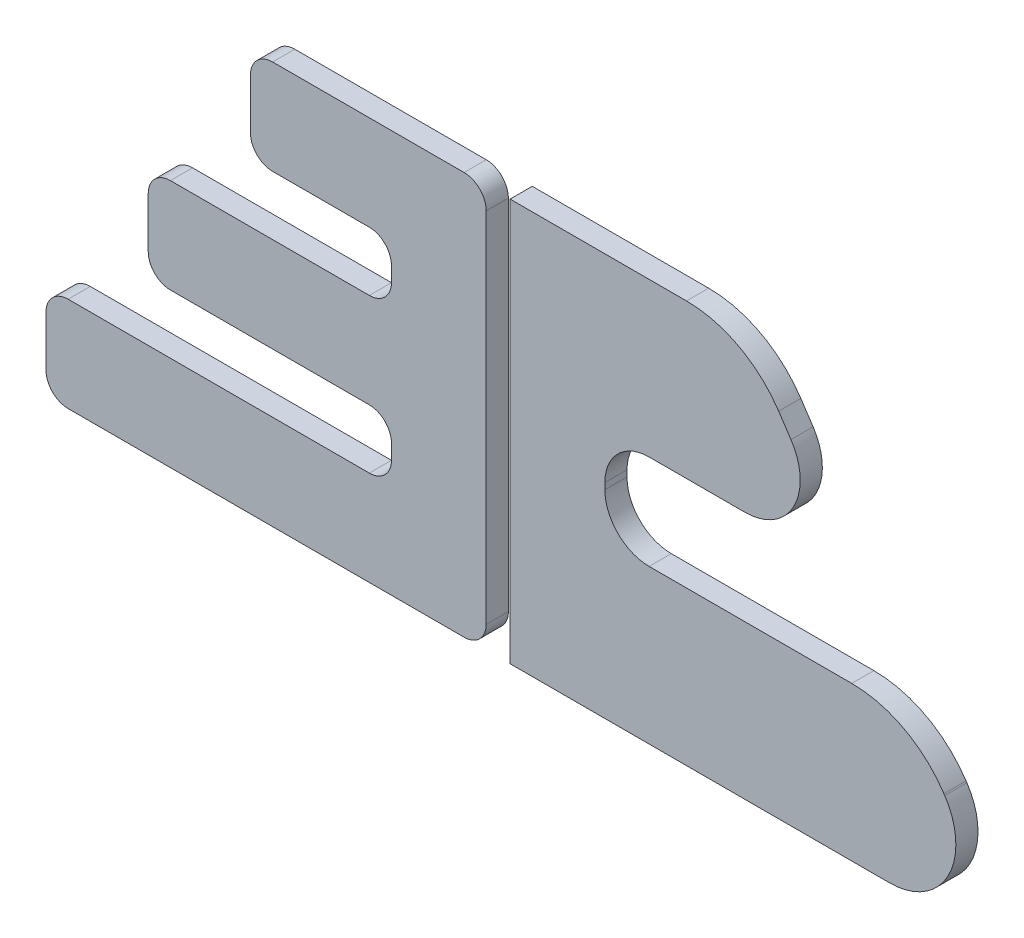
from build123d import *

# Parameters (mm, degrees)
BOSS_EXTRU_1_DEPTH   = 10
BOSS_EXTRU_1_2_DEPTH = 10
CONG_1_R             = 10
CONG_2_R             = 25
CONG_3_R             = 50
CONG_4_R             = 30
CONG_5_R             = 50
CONG_6_R             = 20


with BuildPart() as part:
    # Esquisse1 → Boss.-Extru.1 (new body)
    with BuildSketch(Plane.XY):
        Polygon((0, 181.758294068), (0, 0), (-198.818031305, 0), (-198.818031305, 42.798234664), (-42.798234664, 42.798234664), (-42.798234664, 69.480029702), (-152.64648987, 69.480029702), (-152.64648987, 112.278264366), (-42.798234664, 112.278264366), (-42.798234664, 138.960059404), (-106.474948435, 138.960059404), (-106.474948435, 181.758294068), align=None)
    extrude(amount=BOSS_EXTRU_1_DEPTH)

    # Congé1
    cong_1_edges = [part.edges().sort_by_distance(p)[0] for p in [
        (0, 181.758294068, 5),
        (0, 0, 5),
        (-198.818031305, 0, 5),
        (-198.818031305, 42.798234664, 5),
        (-42.798234664, 42.798234664, 5),
        (-42.798234664, 69.480029702, 5),
        (-152.64648987, 69.480029702, 5),
        (-152.64648987, 112.278264366, 5),
        (-42.798234664, 112.278264366, 5),
        (-42.798234664, 138.960059404, 5),
        (-106.474948435, 138.960059404, 5),
        (-106.474948435, 181.758294068, 5),
    ]]
    fillet(cong_1_edges, radius=CONG_1_R)


with BuildPart() as body_2:
    # Esquisse1 → Boss.-Extru.1 2 (new body)
    with BuildSketch(Plane.XY):
        Polygon((10.782047663, 181.758294068), (10.782047663, 0), (238.062649315, 0), (191.882746402, 69.480029702), (53.580282327, 69.480029702), (53.580282327, 112.278264366), (163.436899011, 112.278264366), (117.256996099, 181.758294068), align=None)
    extrude(amount=BOSS_EXTRU_1_2_DEPTH)

    # Congé2
    cong_2_edges = [body_2.edges().sort_by_distance(p)[0] for p in [
        (163.436899011, 112.278264366, 5),
    ]]
    fillet(cong_2_edges, radius=CONG_2_R)

    # Congé3
    cong_3_edges = [body_2.edges().sort_by_distance(p)[0] for p in [
        (191.882746402, 69.480029702, 5),
    ]]
    fillet(cong_3_edges, radius=CONG_3_R)

    # Congé4
    cong_4_edges = [body_2.edges().sort_by_distance(p)[0] for p in [
        (238.062649315, 0, 5),
    ]]
    fillet(cong_4_edges, radius=CONG_4_R)

    # Congé5
    cong_5_edges = [body_2.edges().sort_by_distance(p)[0] for p in [
        (117.256996099, 181.758294068, 5),
    ]]
    fillet(cong_5_edges, radius=CONG_5_R)

    # Congé6
    cong_6_edges = [body_2.edges().sort_by_distance(p)[0] for p in [
        (53.580282327, 112.278264366, 5),
        (53.580282327, 69.480029702, 5),
    ]]
    fillet(cong_6_edges, radius=CONG_6_R)


solid = Compound([part.part, body_2.part])
